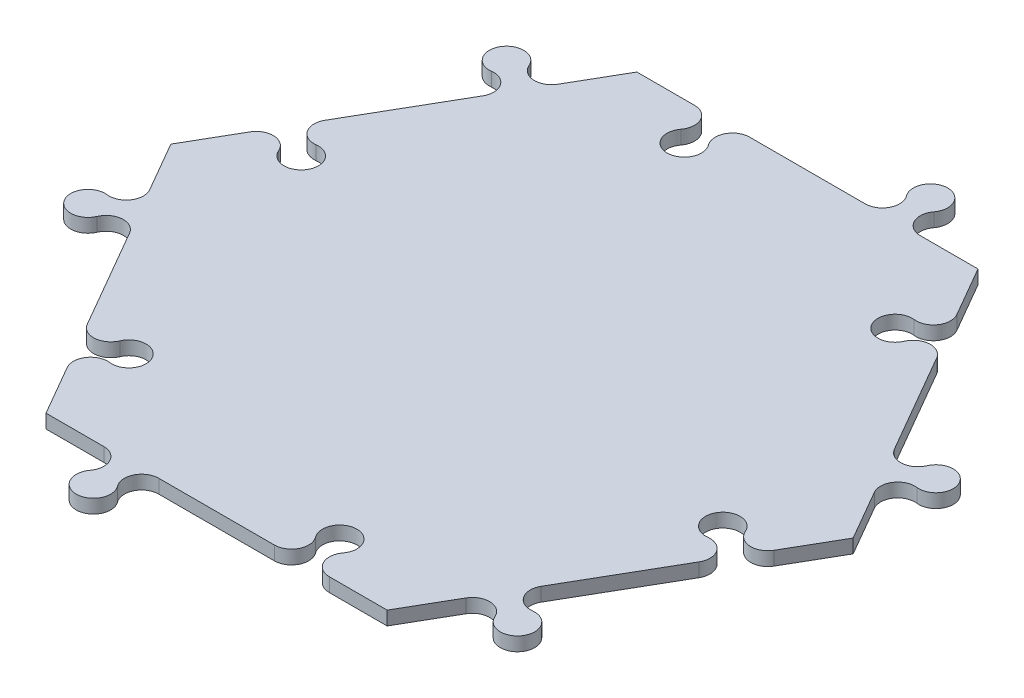
from build123d import *

# Parameters (mm, degrees)
BOSS_EXTRUDE1_DEPTH = 3.175
BOSS_EXTRUDE2_DEPTH = 3.175
CUT_EXTRUDE2_DEPTH  = 113.944871324
CIRPATTERN1_COUNT   = 6


with BuildPart() as part:
    # Sketch1 → Boss-Extrude1 (new body)
    with BuildSketch(Plane(origin=(0, 0, 0), x_dir=(1, 0, 0), z_dir=(0, 1, 0))):
        Polygon((-39.375288359, 68.2), (-78.750576717, 0), (-39.375288359, -68.2), (39.375288359, -68.2), (78.750576717, 0), (39.375288359, 68.2), align=None)
    extrude(amount=BOSS_EXTRUDE1_DEPTH)

    # Sketch2 → Boss-Extrude2 (add)
    with BuildSketch(Plane(origin=(0, 0, 0), x_dir=(1, 0, 0), z_dir=(0, 1, 0))):
        with BuildLine():
            ThreePointArc((16.512644179, 74.55), (16.887402094, 70.393871043), (13.337644179, 68.2))
            Line((13.337644179, 68.2), (26.037644179, 68.2))
            ThreePointArc((26.037644179, 68.2), (22.487886265, 70.393871043), (22.862644179, 74.55))
            ThreePointArc((22.862644179, 74.55), (23.237402094, 78.706128957), (19.687644179, 80.9))
            ThreePointArc((19.687644179, 80.9), (16.137886265, 78.706128957), (16.512644179, 74.55))
        make_face()
    boss_extrude2 = extrude(amount=BOSS_EXTRUDE2_DEPTH)

    # Sketch2<3> → Cut-Extrude2 (cut, through all)
    with BuildSketch(Plane(origin=(0, 0, 0), x_dir=(1, 0, 0), z_dir=(0, 1, 0))):
        with BuildLine():
            Line((-13.337644179, 68.2), (-26.037644179, 68.2))
            ThreePointArc((-26.037644179, 68.2), (-22.487886265, 66.006128957), (-22.862644179, 61.85))
            ThreePointArc((-22.862644179, 61.85), (-23.237402094, 57.693871043), (-19.687644179, 55.5))
            ThreePointArc((-19.687644179, 55.5), (-16.137886265, 57.693871043), (-16.512644179, 61.85))
            ThreePointArc((-16.512644179, 61.85), (-16.887402094, 66.006128957), (-13.337644179, 68.2))
        make_face()
    cut_extrude2 = extrude(amount=CUT_EXTRUDE2_DEPTH, mode=Mode.SUBTRACT)

    # CirPattern1: Boss-Extrude2, Cut-Extrude2 ×6 about axis
    cirpattern1_axis = Axis((0, 0, 0), (0, 1, 0))
    add([boss_extrude2.rotate(cirpattern1_axis, i * 360 / CIRPATTERN1_COUNT) for i in range(1, CIRPATTERN1_COUNT)])
    add([cut_extrude2.rotate(cirpattern1_axis, i * 360 / CIRPATTERN1_COUNT) for i in range(1, CIRPATTERN1_COUNT)], mode=Mode.SUBTRACT)


solid = part.part
